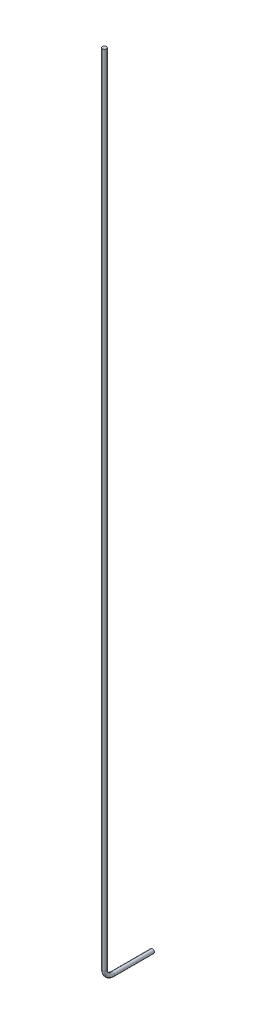
from build123d import *

# Parameters (mm, degrees)
SKETCH_1_R      = 1.27
EXTRUDE_1_DEPTH = 20
SKETCH_2_R      = 1.27


with BuildPart() as part:
    # ｽｹｯﾁ1 → ﾎﾞｽ - 押し出し1 (new body)
    with BuildSketch(Plane.XY):
        Circle(SKETCH_1_R)
    extrude(amount=EXTRUDE_1_DEPTH)

    # ｽｲｰﾌﾟ1: sweep along a path in ｽｹｯﾁ3
    with BuildLine(Plane(origin=(0, 0, 0), x_dir=(0, 0, -1), z_dir=(1, 0, 0))) as sweep_1_path:
        Line((-20, 0), (-25, 0))
        ThreePointArc((-25, 0), (-28.535533906, 1.464466094), (-30, 5))
        Line((-30, 5), (-30, 505))
    # ｽｹｯﾁ2 → ｽｲｰﾌﾟ1 (sweep)
    with BuildSketch(Plane.XY.offset(20)):
        Circle(SKETCH_2_R)
    sweep(path=sweep_1_path.line)


solid = part.part
